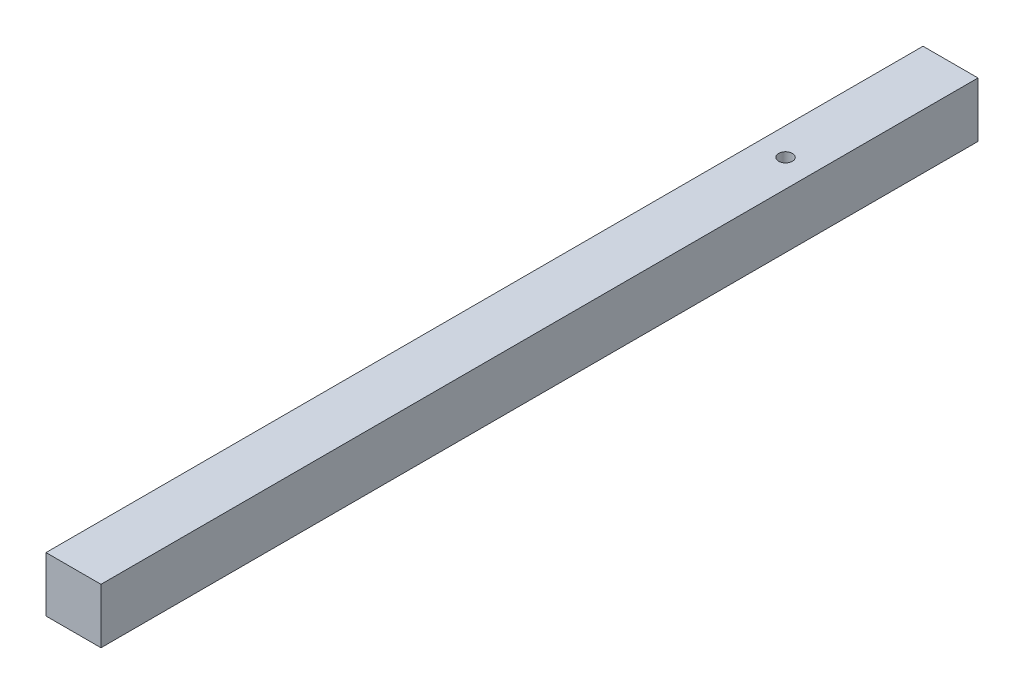
from build123d import *

# Parameters (mm, degrees)
SKETCH_1_W          = 20
SKETCH_1_H          = 20
EXTRUDE_1_DEPTH     = 319
SKETCH_2_R          = 2.5
CUT_EXTRUDE_1_DEPTH = 10


with BuildPart() as part:
    # 草图1 → 凸台-拉伸1 (new body)
    with BuildSketch(Plane.XY):
        with Locations((10, 10)):
            Rectangle(SKETCH_1_W, SKETCH_1_H)
    extrude(amount=EXTRUDE_1_DEPTH)

    # 草图2 → 切除-拉伸1 (cut)
    with BuildSketch(Plane(origin=(0, 20, 0), x_dir=(1, 0, 0), z_dir=(0, 1, 0))):
        with Locations(Location((10, -60, 0), (0, 0, 270))):
            Circle(SKETCH_2_R)
    extrude(amount=-CUT_EXTRUDE_1_DEPTH, mode=Mode.SUBTRACT)


solid = part.part
